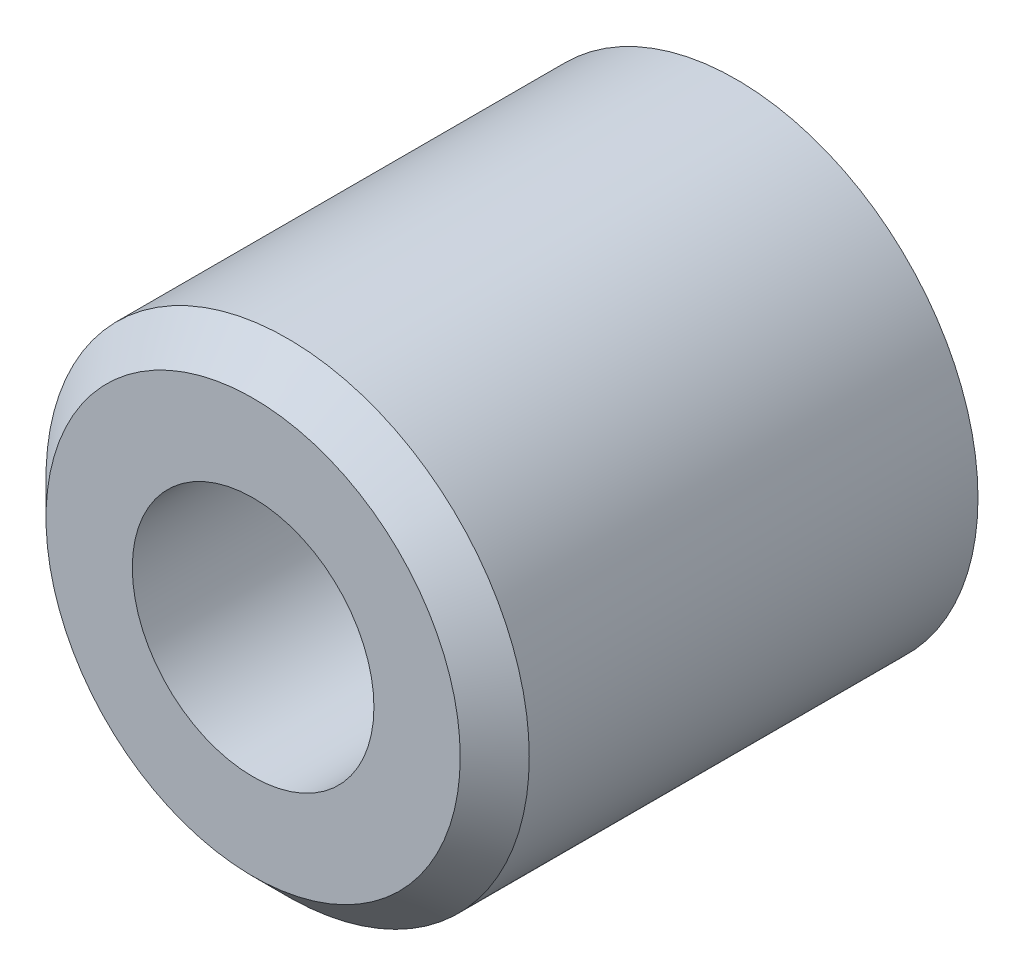
from build123d import *

# Parameters (mm, degrees)
SKETCH_1_R      = 3.5
SKETCH_1_R_2    = 1.75
EXTRUDE_1_DEPTH = 7
CHAMFER_2_SIZE  = 0.5


with BuildPart() as part:
    # Эскиз1 → Бобышка-Вытянуть1 (new body)
    with BuildSketch(Plane.XY):
        Circle(SKETCH_1_R)
        Circle(SKETCH_1_R_2, mode=Mode.SUBTRACT)
    extrude(amount=EXTRUDE_1_DEPTH)

    # Фаска2
    chamfer_2_edges = [part.edges().sort_by_distance(p)[0] for p in [
        (-3.5, 0, 7),
    ]]
    chamfer(chamfer_2_edges, length=CHAMFER_2_SIZE)


solid = part.part
